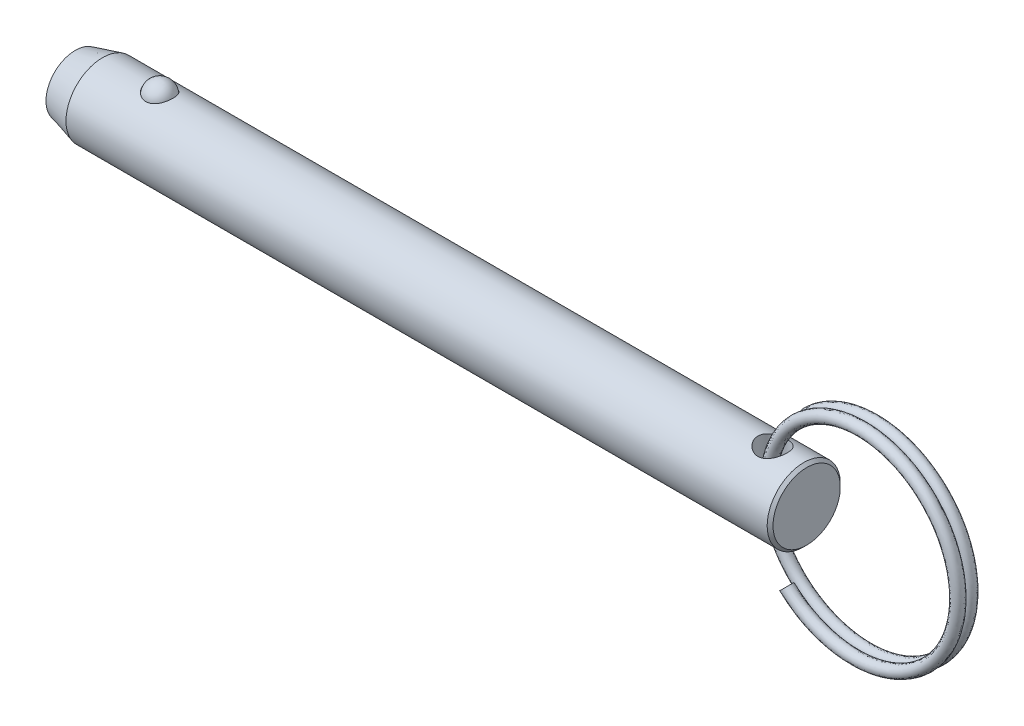
from build123d import *

# Parameters (mm, degrees)
SKETCH4_W          = 1.905
SKETCH4_H          = 9.525
SWEEP1_PITCH       = 1.5494
SWEEP1_HEIGHT      = 1.355725
SWEEP1_RADIUS      = 13.462
SKETCH6_R          = 0.762
SWEEP2_PITCH       = 1.5494
SWEEP2_HEIGHT      = 1.355725
SWEEP2_RADIUS      = 13.462
SWEEP2_START_ANGLE = -180
SKETCH6_2_R        = 0.762


with BuildPart() as part:
    # Sketch1 → Revolve1 (revolve)
    with BuildSketch(Plane.XY, mode=Mode.PRIVATE) as revolve1_sk:
        Polygon((6.35, 4.3815), (5.969, 4.7625), (-85.345221606, 4.7625), (-88.9, 3.81), (-88.9, 0), (6.35, 0), align=None)
    revolve(revolve1_sk.sketch.rotate(Axis((6.35, 0, 0), (1, 0, 0)), 90), axis=Axis((6.35, 0, 0), (1, 0, 0)))

    # Sketch2 → Cut-Revolve1 (revolve, cut)
    with BuildSketch(Plane.XY):
        with BuildLine():
            Line((-76.109387711, 4.28625), (-79.703487711, 4.28625))
            ThreePointArc((-79.703487711, 4.28625), (-77.906437711, 6.0833), (-76.109387711, 4.28625))
        make_face()
    revolve(axis=Axis((-76.109387711, 4.28625, 0), (1, 0, 0)), mode=Mode.SUBTRACT)

    # Sketch4 → Cut-Revolve2 (revolve, cut)
    with BuildSketch(Plane.XY, mode=Mode.PRIVATE) as cut_revolve2_sk:
        with Locations((2.8575, 0)):
            Rectangle(SKETCH4_W, SKETCH4_H)
    revolve(cut_revolve2_sk.sketch.rotate(Axis((1.905, -4.7625, 0), (0, 1, 0)), 90), axis=Axis((1.905, -4.7625, 0), (0, 1, 0)), mode=Mode.SUBTRACT)


with BuildPart() as body_2:
    # Sketch3 → Revolve2 (revolve)
    with BuildSketch(Plane.XY):
        with BuildLine():
            Line((-76.134787711, 4.28625), (-79.678087711, 4.28625))
            ThreePointArc((-79.678087711, 4.28625), (-77.906437711, 6.0579), (-76.134787711, 4.28625))
        make_face()
    revolve(axis=Axis((-76.134787711, 4.28625, 0), (1, 0, 0)))


with BuildPart() as body_3:
    # Sweep1: sweep along a helix
    with BuildLine() as sweep1_path:
        Helix(SWEEP1_PITCH, SWEEP1_HEIGHT, SWEEP1_RADIUS, center=(14.109445847, 0, 0), direction=(0, 0, -1), lefthand=True)
    # Sketch6 → Sweep1 (sweep)
    with BuildSketch(Plane(origin=(114.003847968, 0, 0), x_dir=(0, 0, -1), z_dir=(0, 1, 0))):
        with Locations((0, 112.594402121)):
            Circle(SKETCH6_R)
    sweep(path=sweep1_path.line, is_frenet=True)

    # Sweep2: sweep along a helix
    with BuildLine() as sweep2_path:
        add(Helix(SWEEP2_PITCH, SWEEP2_HEIGHT, SWEEP2_RADIUS, center=(14.109445847, 0, 0), direction=(0, 0, 1), lefthand=True, mode=Mode.PRIVATE).rotate(Axis((14.109445847, 0, 0), (0, 0, 1)), SWEEP2_START_ANGLE))
    # Sketch6<2> → Sweep2 (sweep)
    with BuildSketch(Plane(origin=(114.003847968, 0, 0), x_dir=(0, 0, -1), z_dir=(0, 1, 0))):
        with Locations((0, 112.594402121)):
            Circle(SKETCH6_2_R)
    sweep(path=sweep2_path.line, is_frenet=True)


solid = Compound([part.part, body_2.part, body_3.part])
